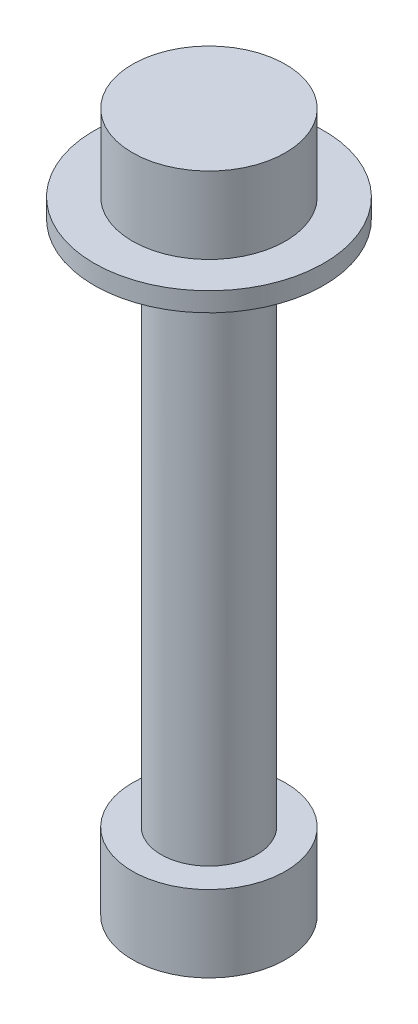
from build123d import *

# Parameters (mm, degrees)
SKETCH1_R           = 3.175
BOSS_EXTRUDE1_DEPTH = 34.925
SKETCH2_R           = 7.62
BOSS_EXTRUDE2_DEPTH = 1.27
SKETCH3_R           = 5.08
BOSS_EXTRUDE3_DEPTH = 5.08
BOSS_EXTRUDE4_START = 5.08
SKETCH4_R           = 5.08
BOSS_EXTRUDE4_DEPTH = 5.08


with BuildPart() as part:
    # Sketch1 → Boss-Extrude1 (new body)
    with BuildSketch(Plane(origin=(0, 0, 0), x_dir=(1, 0, 0), z_dir=(0, 1, 0))):
        with Locations(Location((0, 0, 0), (0, 0, 270))):
            Circle(SKETCH1_R)
    extrude(amount=BOSS_EXTRUDE1_DEPTH)

    # Sketch2 → Boss-Extrude2 (add)
    with BuildSketch(Plane(origin=(0, 34.925, 0), x_dir=(1, 0, 0), z_dir=(0, 1, 0))):
        with Locations(Location((0, 0, 0), (0, 0, 270))):
            Circle(SKETCH2_R)
    extrude(amount=BOSS_EXTRUDE2_DEPTH)

    # Sketch3 → Boss-Extrude3 (add)
    with BuildSketch(Plane.XZ):
        with Locations(Location((0, 0, 0), (0, 0, 270))):
            Circle(SKETCH3_R)
    extrude(amount=BOSS_EXTRUDE3_DEPTH)

    # Sketch4 → Boss-Extrude4 (add)
    with BuildSketch(Plane(origin=(0, 36.195, 0), x_dir=(1, 0, 0), z_dir=(0, 1, 0)).offset(BOSS_EXTRUDE4_START)):
        with Locations(Location((0, 0, 0), (0, 0, 90))):
            Circle(SKETCH4_R)
    extrude(amount=-BOSS_EXTRUDE4_DEPTH)


solid = part.part
